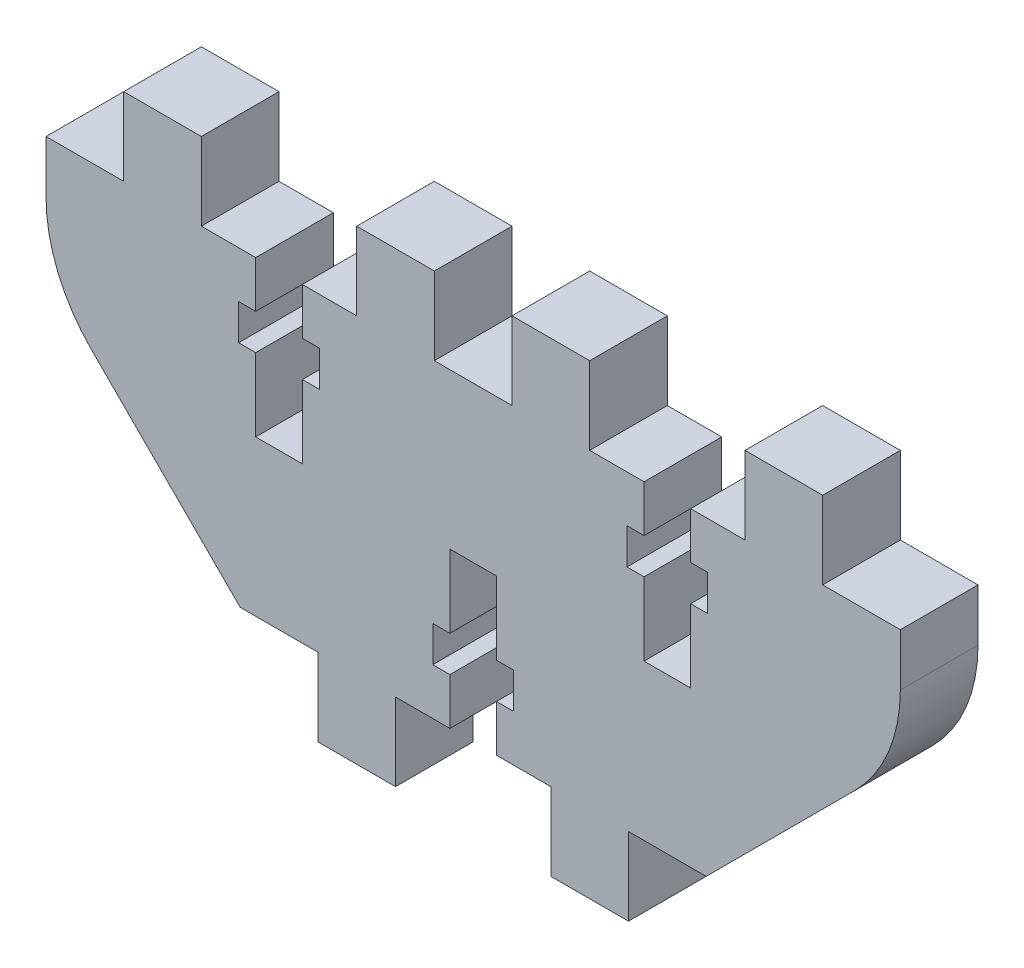
from build123d import *

# Parameters (mm, degrees)
BOSS_EXTRU_1_DEPTH = 5
CONG_1_R           = 10


with BuildPart() as part:
    # Esquisse1 → Boss.-Extru.1 (new body)
    with BuildSketch(Plane.XY):
        Polygon((15, 0), (27.5, 12.5), (27.5, 20), (22.5, 20), (22.5, 25), (17.5, 25), (17.5, 20), (14, 20), (14, 17), (15.1, 17), (15.1, 14.7), (14, 14.7), (14, 10), (11, 10), (11, 14.7), (9.9, 14.7), (9.9, 17), (11, 17), (11, 20), (7.5, 20), (7.5, 25), (2.5, 25), (2.5, 20), (-2.5, 20), (-2.5, 25), (-7.5, 25), (-7.5, 20), (-11, 20), (-11, 17), (-9.9, 17), (-9.9, 14.7), (-11, 14.7), (-11, 10), (-14, 10), (-14, 14.7), (-15.1, 14.7), (-15.1, 17), (-14, 17), (-14, 20), (-17.5, 20), (-17.5, 25), (-22.5, 25), (-22.5, 20), (-27.5, 20), (-27.5, 12.5), (-15, 0), (-10, 0), (-10, -5), (-5, -5), (-5, 0), (-1.5, 0), (-1.5, 3), (-2.6, 3), (-2.6, 5.3), (-1.5, 5.3), (-1.5, 10), (1.5, 10), (1.5, 5.3), (2.6, 5.3), (2.6, 3), (1.5, 3), (1.5, 0), (5, 0), (5, -5), (10, -5), (10, 0), align=None)
    extrude(amount=BOSS_EXTRU_1_DEPTH)

    # Congé1
    cong_1_edges = [part.edges().sort_by_distance(p)[0] for p in [
        (27.5, 12.5, 2.5),
        (-27.5, 12.5, 2.5),
    ]]
    fillet(cong_1_edges, radius=CONG_1_R)


solid = part.part
